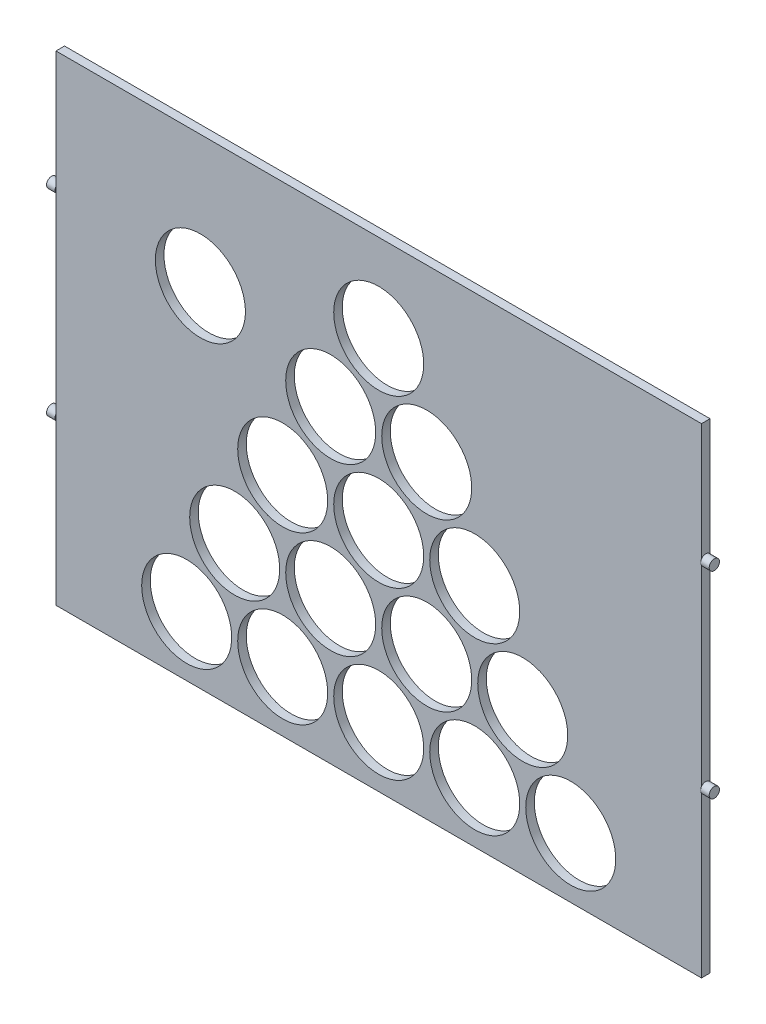
from build123d import *

# Parameters (mm, degrees)
SKETCH_1_W          = 376.5
SKETCH_1_H          = 280
EXTRUDE_1_DEPTH     = 5
SKETCH_2_R          = 26.25
CUT_EXTRUDE_1_DEPTH = 5
SKETCH_3_R          = 3
EXTRUDE_2_DEPTH     = 5
EXTRUDE_START       = 5
SKETCH_4_R          = 3
EXTRUDE_3_DEPTH     = 5


with BuildPart() as part:
    # 草图1 → 凸台-拉伸1 (new body)
    with BuildSketch(Plane.XY):
        with Locations((188.25, 140)):
            Rectangle(SKETCH_1_W, SKETCH_1_H)
    extrude(amount=EXTRUDE_1_DEPTH)

    # 草图2 → 切除-拉伸1 (cut)
    with BuildSketch(Plane.XY.offset(5)):
        with Locations(Location((84.25, 203.497422612, 0), (0, 0, 180))):
            Circle(SKETCH_2_R)
        with Locations(Location((188.25, 228.989690448, 0), (0, 0, 180))):
            Circle(SKETCH_2_R)
        with Locations(Location((160.25, 180.492267836, 0), (0, 0, 180))):
            Circle(SKETCH_2_R)
        with Locations(Location((216.25, 180.492267836, 0), (0, 0, 180))):
            Circle(SKETCH_2_R)
        with Locations(Location((244.25, 131.994845224, 0), (0, 0, 180))):
            Circle(SKETCH_2_R)
        with Locations(Location((132.25, 131.994845224, 0), (0, 0, 180))):
            Circle(SKETCH_2_R)
        with Locations(Location((188.25, 131.994845224, 0), (0, 0, 180))):
            Circle(SKETCH_2_R)
        with Locations(Location((272.25, 83.497422612, 0), (0, 0, 180))):
            Circle(SKETCH_2_R)
        with Locations(Location((216.25, 83.497422612, 0), (0, 0, 180))):
            Circle(SKETCH_2_R)
        with Locations(Location((104.25, 83.497422612, 0), (0, 0, 180))):
            Circle(SKETCH_2_R)
        with Locations(Location((160.25, 83.497422612, 0), (0, 0, 180))):
            Circle(SKETCH_2_R)
        with Locations(Location((300.25, 35, 0), (0, 0, 180))):
            Circle(SKETCH_2_R)
        with Locations(Location((244.25, 35, 0), (0, 0, 180))):
            Circle(SKETCH_2_R)
        with Locations(Location((188.25, 35, 0), (0, 0, 180))):
            Circle(SKETCH_2_R)
        with Locations(Location((132.25, 35, 0), (0, 0, 180))):
            Circle(SKETCH_2_R)
        with Locations(Location((76.25, 35, 0), (0, 0, 180))):
            Circle(SKETCH_2_R)
    extrude(amount=-CUT_EXTRUDE_1_DEPTH, mode=Mode.SUBTRACT)

    # 草图3 → 凸台-拉伸2 (add)
    with BuildSketch(Plane.ZY):
        with Locations(Location((2.5, 210, 0), (0, 0, 213.557309762))):
            Circle(SKETCH_3_R)
        with Locations(Location((2.5, 95, 0), (0, 0, 213.557309762))):
            Circle(SKETCH_3_R)
    extrude(amount=EXTRUDE_2_DEPTH)

    # 草图4 → 凸台-拉伸3 (add)
    with BuildSketch(Plane(origin=(376.5, 0, 0), x_dir=(0, 0, -1), z_dir=(1, 0, 0)).offset(EXTRUDE_START)):
        with Locations(Location((-2.5, 210, 0), (0, 0, 326.442690238))):
            Circle(SKETCH_4_R)
        with Locations(Location((-2.5, 95, 0), (0, 0, 326.442690238))):
            Circle(SKETCH_4_R)
    extrude(amount=-EXTRUDE_3_DEPTH)


solid = part.part
